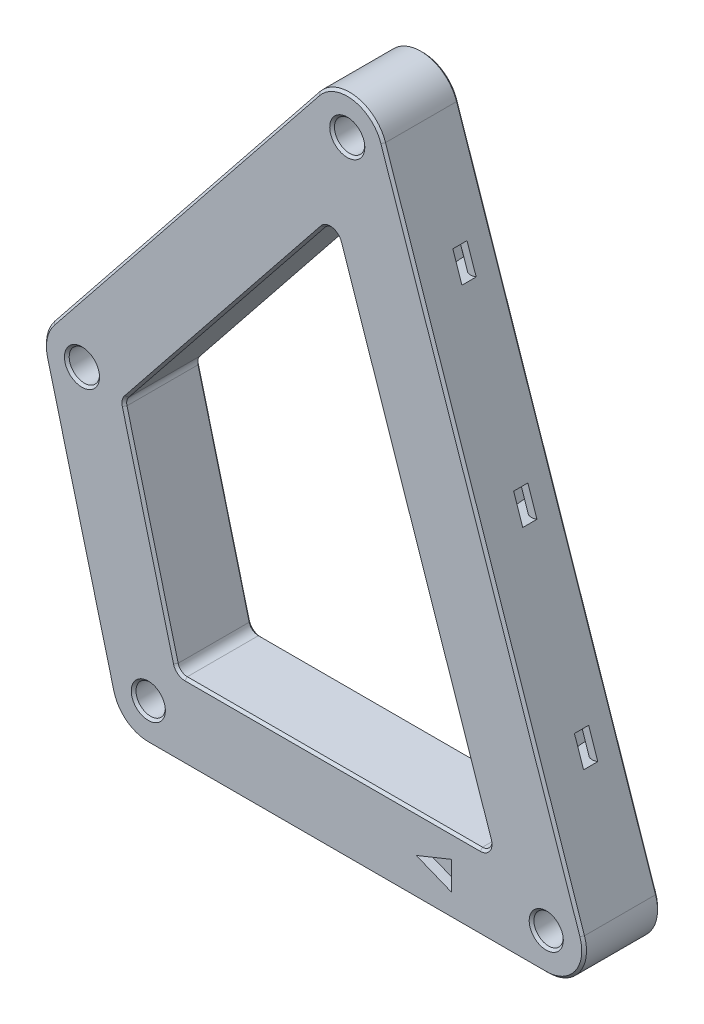
from build123d import *

# Parameters (mm, degrees)
SZKIC1_R                    = 1.55
SZKIC1_R_2                  = 1.6
DODANIE_WYCI_GNI_CIE1_DEPTH = 8
ZAOKR_GLENIE1_R             = 4
SZKIC2_R                    = 3
WYTNIJ_WYCI_GNI_CIE1_DEPTH  = 3
ZAOKR_GLENIE2_R             = 1
SFAZOWANIE1_SIZE            = 0.25
WYTNIJ_WYCI_GNI_CIE2_DEPTH  = 1
WYTNIJ_WYCI_GNI_CIE3_DEPTH  = 3
SZYK_LINIOWY1_COUNT         = 3
SZYK_LINIOWY1_PITCH         = 20


with BuildPart() as part:
    # Szkic1 → Dodanie-wyciągnięcie1 (new body)
    with BuildSketch(Plane.XY):
        Polygon((-32.374614688, -34.065144123), (1.443331859, 8.207289062), (26.5780588, -66), (-24.095207609, -66), align=None)
        with Locations((-21, -62)):
            Circle(SZKIC1_R, mode=Mode.SUBTRACT)
        with Locations((21, -62)):
            Circle(SZKIC1_R, mode=Mode.SUBTRACT)
        Circle(SZKIC1_R_2, mode=Mode.SUBTRACT)
        with Locations((-28, -35)):
            Circle(SZKIC1_R_2, mode=Mode.SUBTRACT)
        Polygon((-23.625385312, -35.934855877), (-1.443331859, -8.207289062), (15.4219412, -58), (-17.904792391, -58), align=None, mode=Mode.SUBTRACT)
    extrude(amount=DODANIE_WYCI_GNI_CIE1_DEPTH)

    # Zaokrąglenie1
    zaokr_glenie1_edges = [part.edges().sort_by_distance(p)[0] for p in [
        (-32.374614688, -34.065144123, 4),
        (1.443331859, 8.207289062, 4),
        (26.5780588, -66, 4),
        (-24.095207609, -66, 4),
    ]]
    fillet(zaokr_glenie1_edges, radius=ZAOKR_GLENIE1_R)

    # Szkic2 → Wytnij-wyciągnięcie1 (cut)
    with BuildSketch(Plane.XY):
        Circle(SZKIC2_R)
        with Locations((-28, -35)):
            Circle(SZKIC2_R)
        with Locations((-21, -62)):
            Circle(SZKIC2_R)
        with Locations((21, -62)):
            Circle(SZKIC2_R)
    extrude(amount=WYTNIJ_WYCI_GNI_CIE1_DEPTH, mode=Mode.SUBTRACT)

    # Zaokrąglenie2
    zaokr_glenie2_edges = [part.edges().sort_by_distance(p)[0] for p in [
        (-23.625385312, -35.934855877, 4),
        (-17.904792391, -58, 4),
        (15.4219412, -58, 4),
        (-1.443331859, -8.207289062, 4),
    ]]
    fillet(zaokr_glenie2_edges, radius=ZAOKR_GLENIE2_R)

    # Sfazowanie1
    sfazowanie1_edges = [part.edges().sort_by_distance(p)[0] for p in [
        (7.058775414, -33.30874863, 0),
        (7.058775414, -33.30874863, 8),
        (-20.799357962, -46.835247082, 0),
        (-20.799357962, -46.835247082, 8),
        (-12.948817041, -22.589145539, 0),
        (-12.948817041, -22.589145539, 8),
        (14.84007865, -57.582749074, 0),
        (14.84007865, -57.582749074, 8),
        (-17.742969998, -57.790873618, 0),
        (-17.742969998, -57.790873618, 8),
        (-23.509651218, -35.959588272, 0),
        (-23.509651218, -35.959588272, 8),
        (-1.630962951, -9.274224983, 0),
        (-1.630962951, -9.274224983, 8),
        (-22.55, -62, 8),
        (19.45, -62, 8),
        (-1.6, 0, 8),
        (-29.6, -35, 8),
        (0, -66, 0),
        (0, -66, 8),
        (-28.371987593, -49.503848635, 0),
        (-17.123475238, -15.00121981, 0),
        (14.288578303, -29.716771865, 0),
        (0.692807492, 3.939545377, 0),
        (24.2506086, -64.330996296, 0),
        (-31.911678313, -34.164073702, 0),
        (-23.44791804, -65.163494471, 0),
        (-28.371987593, -49.503848635, 8),
        (14.288578303, -29.716771865, 8),
        (-17.123475238, -15.00121981, 8),
        (0.692807492, 3.939545377, 8),
        (24.2506086, -64.330996296, 8),
        (-31.911678313, -34.164073702, 8),
        (-23.44791804, -65.163494471, 8),
        (-1.551781994, -58, 0),
        (-1.551781994, -58, 8),
    ]]
    chamfer(sfazowanie1_edges, length=SFAZOWANIE1_SIZE)

    # Szkic3 → Wytnij-wyciągnięcie2 (cut)
    with BuildSketch(Plane(origin=(0, 0, 8), x_dir=(-1, 0, 0), z_dir=(0, 0, -1))):
        Polygon((-11, -60.5), (-11, -63.5), (-7.291900756, -62), align=None)
    extrude(amount=WYTNIJ_WYCI_GNI_CIE2_DEPTH, mode=Mode.SUBTRACT)

    # Szkic4 → Wytnij-wyciągnięcie3 (cut)
    with BuildSketch(Plane(origin=(19.976472797, -46.509603231, 0.25), x_dir=(0.9471445756278131, 0.3208070336803883, 0), z_dir=(-0.3208070336803883, 0.9471445756278131, 0))):
        with BuildLine():
            Line((-4, 0.25), (-2.5, 0.25))
            ThreePointArc((-2.5, 0.25), (-1.767766953, -1.517766953), (0, -2.25))
            Line((0, -2.25), (0, -3.75))
            ThreePointArc((0, -3.75), (-2.828427125, -2.578427125), (-4, 0.25))
        make_face()
    wytnij_wyci_gni_cie3 = extrude(amount=-WYTNIJ_WYCI_GNI_CIE3_DEPTH, mode=Mode.SUBTRACT)

    # Szyk liniowy1: Wytnij-wyciągnięcie3 ×3
    with Locations(*[Vector(-0.3208070336803885, 0.9471445756278131, 0) * (i * SZYK_LINIOWY1_PITCH) for i in range(1, SZYK_LINIOWY1_COUNT)]):
        add(wytnij_wyci_gni_cie3, mode=Mode.SUBTRACT)


solid = part.part
